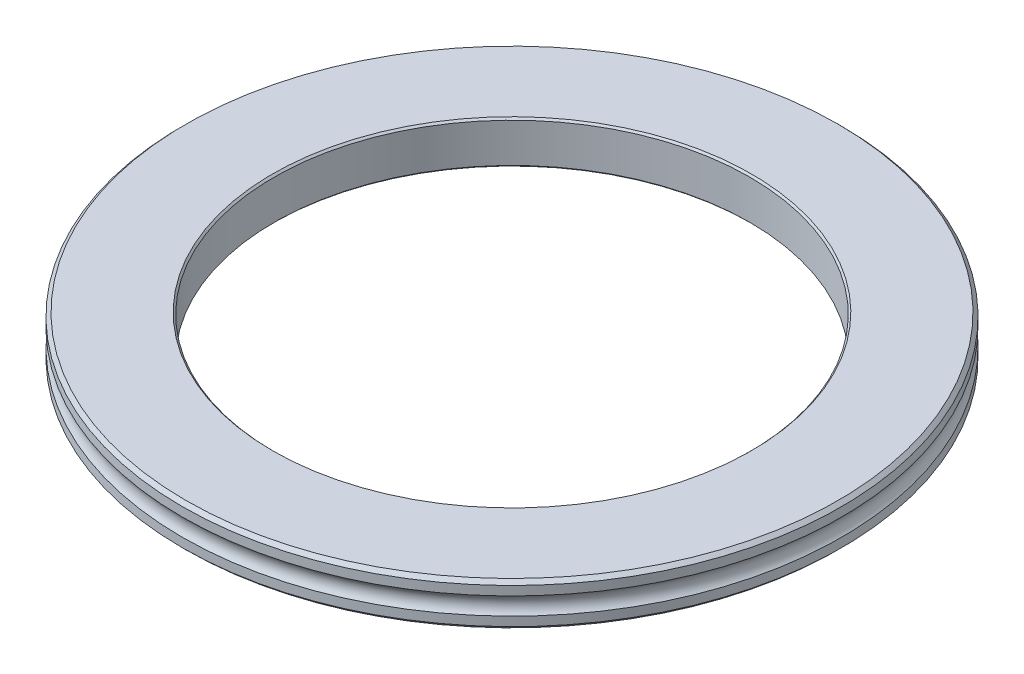
from build123d import *

# Parameters (mm, degrees)
HOLE_WIZARD_2_D = 133.5
CHAMFER_1_SIZE  = 0.5
CHAMFER_2_SIZE2 = 1.000000001
CHAMFER_2_SIZE  = 0.999999999


with BuildPart() as part:
    # 草圖1 → 旋轉1 (revolve)
    with BuildSketch(Plane.XY, mode=Mode.PRIVATE) as revolve_1_sk:
        with BuildLine():
            Line((92.5, 6), (0, 6))
            Line((0, 6), (0, -6))
            Line((0, -6), (92.5, -6))
            Line((92.5, -6), (92.5, -2.449489743))
            ThreePointArc((92.5, -2.449489743), (91.5, 0), (92.5, 2.449489743))
            Line((92.5, 2.449489743), (92.5, 6))
        make_face()
    revolve(revolve_1_sk.sketch.rotate(Axis((0, 6, 0), (0, -1, 0)), 270), axis=Axis((0, 6, 0), (0, -1, 0)))

    # 鑽孔2 (through all)
    with Locations(Plane(origin=(0, -6, 0), x_dir=(-1, 0, 0), z_dir=(0, -1, 0))):
        with Locations((0, 0)):
            Hole(HOLE_WIZARD_2_D / 2)

    # 導角1
    chamfer_1_edges = [part.edges().sort_by_distance(p)[0] for p in [
        (-66.75, -6, 0),
        (-66.75, 6, 0),
    ]]
    chamfer(chamfer_1_edges, length=CHAMFER_1_SIZE)

    # 導角2
    chamfer_2_edges = [part.edges().sort_by_distance(p)[0] for p in [
        (0, 6, 92.5),
        (0, -6, 92.5),
    ]]
    chamfer(chamfer_2_edges, length=CHAMFER_2_SIZE, length2=CHAMFER_2_SIZE2)


solid = part.part
